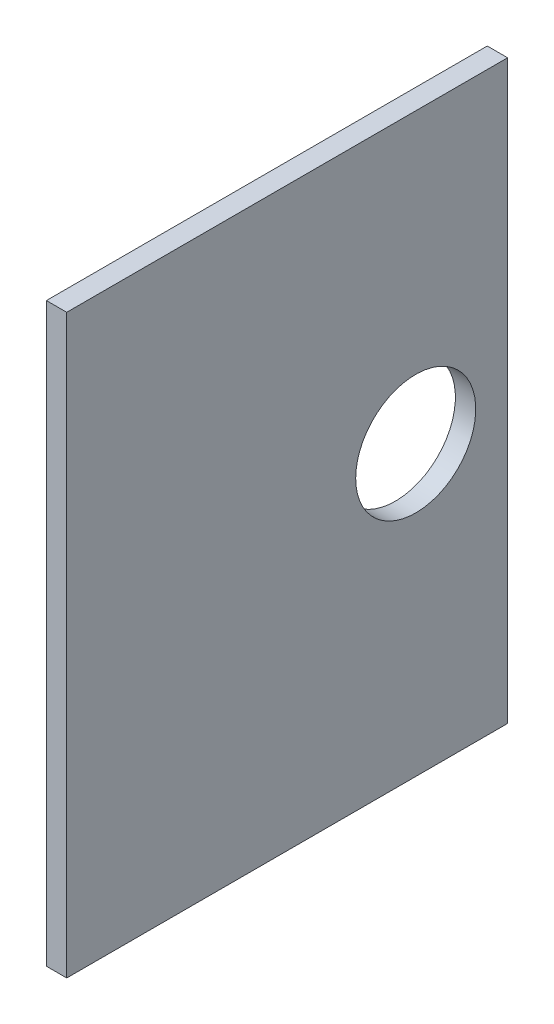
from build123d import *

# Parameters (mm, degrees)
SKETCH1_W           = 165.1
SKETCH1_H           = 215.9
SKETCH1_R           = 22.479
BOSS_EXTRUDE1_DEPTH = 7.62


with BuildPart() as part:
    # Sketch1 → Boss-Extrude1 (new body)
    with BuildSketch(Plane(origin=(0, 0, 0), x_dir=(0, 0, -1), z_dir=(1, 0, 0))):
        Rectangle(SKETCH1_W, SKETCH1_H)
        with Locations(Location((48.132906706, 0, 0), (0, 0, 180))):
            Circle(SKETCH1_R, mode=Mode.SUBTRACT)
    extrude(amount=BOSS_EXTRUDE1_DEPTH)


solid = part.part
